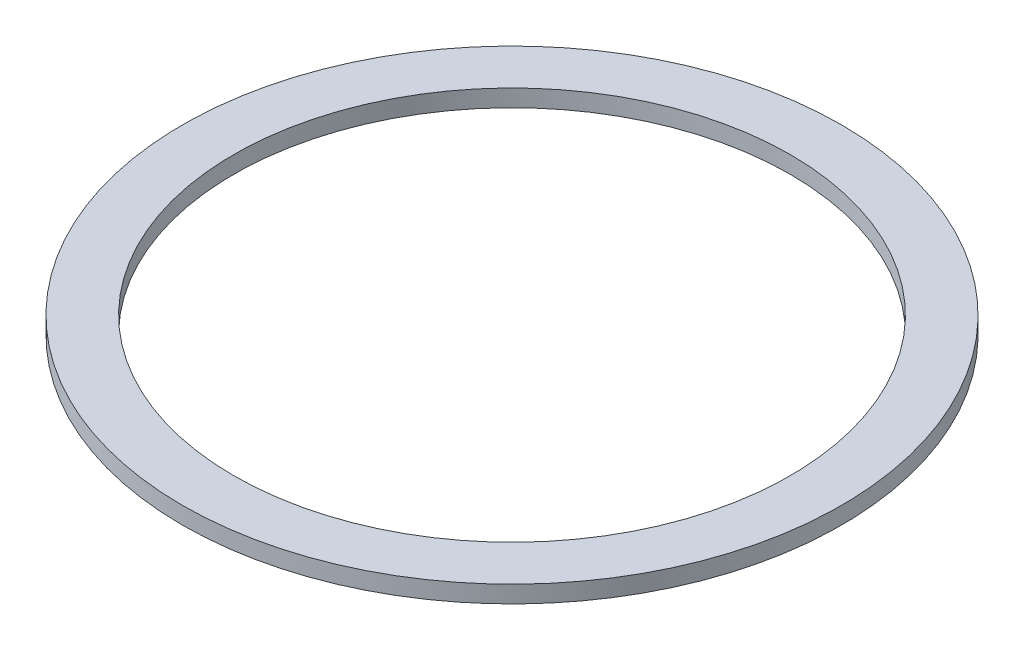
from build123d import *

# Parameters (mm, degrees)
SKETCH1_R           = 192.5
SKETCH1_R_2         = 162.5
BOSS_EXTRUDE1_DEPTH = 5


with BuildPart() as part:
    # Sketch1 → Boss-Extrude1 (new, symmetric)
    with BuildSketch(Plane(origin=(0, 0, 0), x_dir=(1, 0, 0), z_dir=(0, 1, 0))):
        with Locations(Location((0, 0, 0), (0, 0, 270))):
            Circle(SKETCH1_R)
        with Locations(Location((0, 0, 0), (0, 0, 270))):
            Circle(SKETCH1_R_2, mode=Mode.SUBTRACT)
    extrude(amount=BOSS_EXTRUDE1_DEPTH, both=True)


solid = part.part
